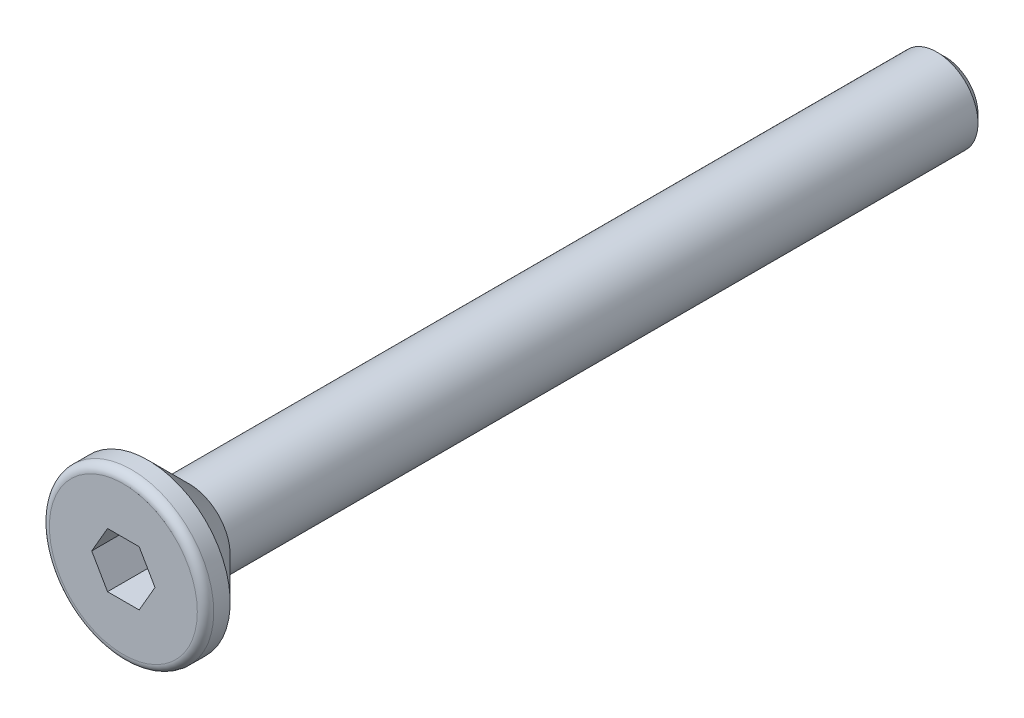
from build123d import *

# Parameters (mm, degrees)
CUT_EXTRUDE_1_DEPTH = 1.5
FILLET_1_R          = 0.3


with BuildPart() as part:
    # 草图1 → 旋转1 (revolve)
    with BuildSketch(Plane(origin=(0, 0, 0), x_dir=(0, 0, -1), z_dir=(1, 0, 0)), mode=Mode.PRIVATE) as revolve_1_sk:
        Polygon((-15, 0), (-15, 3), (-14.1, 3), (-12.6, 1.5), (14.7, 1.5), (15, 1.2), (15, 0), align=None)
    revolve(revolve_1_sk.sketch.rotate(Axis((0, 0, -15), (0, 0, 1)), 90), axis=Axis((0, 0, -15), (0, 0, 1)))

    # 草图2 → 切除-拉伸1 (cut)
    with BuildSketch(Plane.XY.offset(15)):
        Polygon((1.154700538, 0), (0.577350269, 1), (-0.577350269, 1), (-1.154700538, 0), (-0.577350269, -1), (0.577350269, -1), align=None)
    extrude(amount=-CUT_EXTRUDE_1_DEPTH, mode=Mode.SUBTRACT)

    # 圆角1
    fillet_1_edges = [part.edges().sort_by_distance(p)[0] for p in [
        (3, 0, 15),
    ]]
    fillet(fillet_1_edges, radius=FILLET_1_R)


solid = part.part
